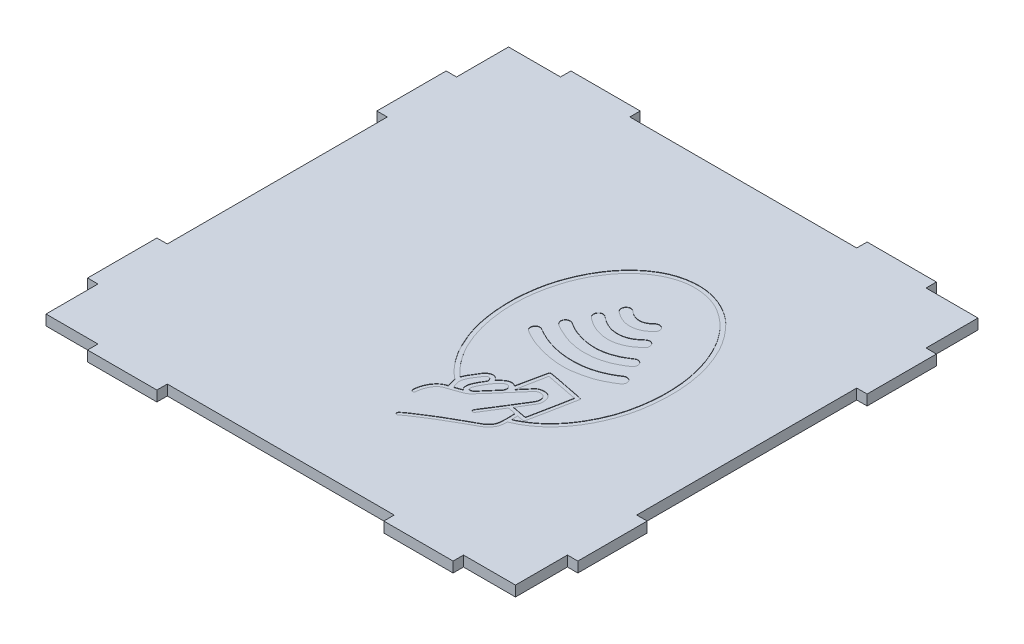
from build123d import *

# Parameters (mm, degrees)
SKETCH1_W           = 135.499999433
SKETCH1_H           = 133.500000388
BOSS_EXTRUDE1_DEPTH = 3
SKETCH2_W           = 3
SKETCH2_H           = 20
SKETCH2_W_2         = 20
SKETCH2_H_2         = 3
BOSS_EXTRUDE2_DEPTH = 3
CUT_EXTRUDE1_DEPTH  = 0.1


with BuildPart() as part:
    # Sketch1 → Boss-Extrude1 (new body)
    with BuildSketch(Plane(origin=(0, 0, 0), x_dir=(1, 0, 0), z_dir=(0, 1, 0))):
        with Locations((16.289033152, -9.949375056)):
            Rectangle(SKETCH1_W, SKETCH1_H)
    extrude(amount=BOSS_EXTRUDE1_DEPTH)

    # Sketch2 → Boss-Extrude2 (add, through all)
    with BuildSketch(Plane(origin=(0, 3, 0), x_dir=(1, 0, 0), z_dir=(0, 1, 0))):
        with Locations((85.539032868, 31.800625138)):
            Rectangle(SKETCH2_W, SKETCH2_H)
        with Locations((85.539032868, -51.69937525)):
            Rectangle(SKETCH2_W, SKETCH2_H)
        with Locations((59.039032868, 58.300625138)):
            Rectangle(SKETCH2_W_2, SKETCH2_H_2)
        with Locations((-26.460966565, 58.300625138)):
            Rectangle(SKETCH2_W_2, SKETCH2_H_2)
        with Locations((-52.960966565, 31.800625138)):
            Rectangle(SKETCH2_W, SKETCH2_H)
        with Locations((-52.960966565, -51.69937525)):
            Rectangle(SKETCH2_W, SKETCH2_H)
        with Locations((-26.460966565, -78.19937525)):
            Rectangle(SKETCH2_W_2, SKETCH2_H_2)
        with Locations((59.039032868, -78.19937525)):
            Rectangle(SKETCH2_W_2, SKETCH2_H_2)
    extrude(amount=-BOSS_EXTRUDE2_DEPTH)

    # Sketch3 → Cut-Extrude1 (cut)
    # profile 1 of 5: a face of its own
    with BuildSketch(Plane(origin=(0, 3, 0), x_dir=(1, 0, 0), z_dir=(0, 1, 0))):
        with BuildLine():
            Line((34.113919472, -30.520381706), (36.462919472, -27.796681706))
            add(Edge.make_bspline(
                [(36.462919472, -27.796681706), (36.724119472, -27.514181706), (36.884819472, -27.340481706), (37.062419472, -27.114381706)],
                knots=[0.144736842, 0.144736842, 0.144736842, 0.144736842, 0.157894737, 0.157894737, 0.157894737, 0.157894737], degree=3))
            Line((37.062419472, -27.114381706), (38.248619472, -25.733481706))
            add(Edge.make_bspline(
                [(38.248619472, -25.733481706), (39.168819472, -24.607781706), (41.105019472, -24.897481706), (41.282419472, -26.573781706)],
                knots=[0.171052632, 0.171052632, 0.171052632, 0.171052632, 0.184210526, 0.184210526, 0.184210526, 0.184210526], degree=3))
            add(Edge.make_bspline(
                [(41.282419472, -26.573781706), (41.413619472, -27.814081706), (40.244919472, -29.062881706), (39.663919472, -30.104281706)],
                knots=[0.184210526, 0.184210526, 0.184210526, 0.184210526, 0.197368421, 0.197368421, 0.197368421, 0.197368421], degree=3))
            add(Edge.make_bspline(
                [(39.663919472, -30.104281706), (39.061319472, -31.184381706), (38.339819472, -32.240581706), (37.705619472, -33.282181706)],
                knots=[0.197368421, 0.197368421, 0.197368421, 0.197368421, 0.210526316, 0.210526316, 0.210526316, 0.210526316], degree=3))
            add(Edge.make_bspline(
                [(37.705619472, -33.282181706), (37.027619472, -34.395381706), (36.380419472, -35.344381706), (35.718619472, -36.432181706)],
                knots=[0.210526316, 0.210526316, 0.210526316, 0.210526316, 0.223684211, 0.223684211, 0.223684211, 0.223684211], degree=3))
            add(Edge.make_bspline(
                [(35.718619472, -36.432181706), (35.244019472, -37.212081706), (34.645919472, -37.971481706), (34.221619472, -38.788281706)],
                knots=[0.223684211, 0.223684211, 0.223684211, 0.223684211, 0.236842105, 0.236842105, 0.236842105, 0.236842105], degree=3))
            add(Edge.make_bspline(
                [(34.221619472, -38.788281706), (34.040219472, -39.137581706), (34.170019472, -39.548481706), (34.599719472, -39.569881706)],
                knots=[0.236842105, 0.236842105, 0.236842105, 0.236842105, 0.25, 0.25, 0.25, 0.25], degree=3))
            add(Edge.make_bspline(
                [(34.599719472, -39.569881706), (35.000419472, -39.589881706), (35.115719472, -39.261981706), (35.310919472, -38.968281706)],
                knots=[0.25, 0.25, 0.25, 0.25, 0.263157895, 0.263157895, 0.263157895, 0.263157895], degree=3))
            add(Edge.make_bspline(
                [(35.310919472, -38.968281706), (35.496219472, -38.689581706), (35.620919472, -38.451581706), (35.803419472, -38.175081706)],
                knots=[0.263157895, 0.263157895, 0.263157895, 0.263157895, 0.276315789, 0.276315789, 0.276315789, 0.276315789], degree=3))
            add(Edge.make_bspline(
                [(35.803419472, -38.175081706), (36.089219472, -37.742281706), (38.603719472, -33.849081706), (38.762619472, -33.456381706)],
                knots=[0.276315789, 0.276315789, 0.276315789, 0.276315789, 0.289473684, 0.289473684, 0.289473684, 0.289473684], degree=3))
            add(Edge.make_bspline(
                [(38.762619472, -33.456381706), (39.336519472, -33.572381706), (40.618619472, -33.750081706), (41.081219472, -33.955381706)],
                knots=[0.289473684, 0.289473684, 0.289473684, 0.289473684, 0.302631579, 0.302631579, 0.302631579, 0.302631579], degree=3))
            add(Edge.make_bspline(
                [(41.081219472, -33.955381706), (41.209919472, -34.967681706), (41.165219472, -36.951181706), (41.087519472, -38.003681706)],
                knots=[0.302631579, 0.302631579, 0.302631579, 0.302631579, 0.315789474, 0.315789474, 0.315789474, 0.315789474], degree=3))
            add(Edge.make_bspline(
                [(41.087519472, -38.003681706), (40.890719472, -40.670381706), (38.284119472, -41.465981706), (36.307419472, -42.598581706)],
                knots=[0.315789474, 0.315789474, 0.315789474, 0.315789474, 0.328947368, 0.328947368, 0.328947368, 0.328947368], degree=3))
            add(Edge.make_bspline(
                [(36.307419472, -42.598581706), (36.058019472, -42.741581706), (35.851419472, -42.860081706), (35.616519472, -42.995581706)],
                knots=[0.328947368, 0.328947368, 0.328947368, 0.328947368, 0.342105263, 0.342105263, 0.342105263, 0.342105263], degree=3))
            add(Edge.make_bspline(
                [(35.616519472, -42.995581706), (33.473519472, -44.230681706), (31.072319472, -45.497781706), (29.024719472, -46.869781706)],
                knots=[0.342105263, 0.342105263, 0.342105263, 0.342105263, 0.355263158, 0.355263158, 0.355263158, 0.355263158], degree=3))
            Line((29.024719472, -46.869781706), (26.486319472, -48.501081706))
            add(Edge.make_bspline(
                [(26.486319472, -48.501081706), (25.663419472, -49.061381706), (24.760219472, -49.618181706), (24.029719472, -50.285681706)],
                knots=[0.368421053, 0.368421053, 0.368421053, 0.368421053, 0.381578947, 0.381578947, 0.381578947, 0.381578947], degree=3))
            add(Edge.make_bspline(
                [(24.029719472, -50.285681706), (23.475419472, -50.792181706), (24.011719472, -51.495981706), (24.602719472, -51.120681706)],
                knots=[0.381578947, 0.381578947, 0.381578947, 0.381578947, 0.394736842, 0.394736842, 0.394736842, 0.394736842], degree=3))
            add(Edge.make_bspline(
                [(24.602719472, -51.120681706), (24.698219472, -51.060081706), (24.785919472, -50.953681706), (24.879619472, -50.882181706)],
                knots=[0.394736842, 0.394736842, 0.394736842, 0.394736842, 0.407894737, 0.407894737, 0.407894737, 0.407894737], degree=3))
            Line((24.879619472, -50.882181706), (25.799219472, -50.198281706))
            add(Edge.make_bspline(
                [(25.799219472, -50.198281706), (27.664519472, -48.853681706), (29.151819472, -48.055481706), (30.862219472, -46.916781706)],
                knots=[0.421052632, 0.421052632, 0.421052632, 0.421052632, 0.434210526, 0.434210526, 0.434210526, 0.434210526], degree=3))
            Line((30.862219472, -46.916781706), (36.185719472, -43.831881706))
            add(Edge.make_bspline(
                [(36.185719472, -43.831881706), (37.343819472, -43.098781706), (39.190119472, -42.361981706), (40.177419472, -41.528881706)],
                knots=[0.447368421, 0.447368421, 0.447368421, 0.447368421, 0.460526316, 0.460526316, 0.460526316, 0.460526316], degree=3))
            add(Edge.make_bspline(
                [(40.177419472, -41.528881706), (40.380319472, -41.357681706), (40.513719472, -41.198281706), (40.707919472, -41.028281706)],
                knots=[0.460526316, 0.460526316, 0.460526316, 0.460526316, 0.473684211, 0.473684211, 0.473684211, 0.473684211], degree=3))
            add(Edge.make_bspline(
                [(40.707919472, -41.028281706), (40.952419472, -40.814281706), (41.019619472, -40.676081706), (41.204419472, -40.432381706)],
                knots=[0.473684211, 0.473684211, 0.473684211, 0.473684211, 0.486842105, 0.486842105, 0.486842105, 0.486842105], degree=3))
            add(Edge.make_bspline(
                [(41.204419472, -40.432381706), (42.177719472, -39.149081706), (41.902419472, -38.799981706), (42.133219472, -37.102381706)],
                knots=[0.486842105, 0.486842105, 0.486842105, 0.486842105, 0.5, 0.5, 0.5, 0.5], degree=3))
            add(Edge.make_bspline(
                [(42.133219472, -37.102381706), (42.688919472, -36.785481706), (43.560519472, -36.476181706), (44.213719472, -36.130381706)],
                knots=[0.5, 0.5, 0.5, 0.5, 0.513157895, 0.513157895, 0.513157895, 0.513157895], degree=3))
            add(Edge.make_bspline(
                [(44.213719472, -36.130381706), (45.519119472, -35.439181706), (46.781019472, -34.547481706), (47.897119472, -33.649881706)],
                knots=[0.513157895, 0.513157895, 0.513157895, 0.513157895, 0.526315789, 0.526315789, 0.526315789, 0.526315789], degree=3))
            add(Edge.make_bspline(
                [(47.897119472, -33.649881706), (48.757119472, -32.958181706), (49.555119472, -32.169981706), (50.308219472, -31.373981706)],
                knots=[0.526315789, 0.526315789, 0.526315789, 0.526315789, 0.539473684, 0.539473684, 0.539473684, 0.539473684], degree=3))
            add(Edge.make_bspline(
                [(50.308219472, -31.373981706), (50.433619472, -31.241381706), (50.522319472, -31.092581706), (50.657319472, -30.948081706)],
                knots=[0.539473684, 0.539473684, 0.539473684, 0.539473684, 0.552631579, 0.552631579, 0.552631579, 0.552631579], degree=3))
            Line((50.657319472, -30.948081706), (52.052119472, -29.263781706))
            add(Edge.make_bspline(
                [(52.052119472, -29.263781706), (53.104219472, -27.903081706), (53.908919472, -26.477981706), (54.748219472, -24.958581706)],
                knots=[0.565789474, 0.565789474, 0.565789474, 0.565789474, 0.578947368, 0.578947368, 0.578947368, 0.578947368], degree=3))
            add(Edge.make_bspline(
                [(54.748219472, -24.958581706), (55.461519472, -23.667281706), (56.100519472, -22.079381706), (56.634619472, -20.678481706)],
                knots=[0.578947368, 0.578947368, 0.578947368, 0.578947368, 0.592105263, 0.592105263, 0.592105263, 0.592105263], degree=3))
            add(Edge.make_bspline(
                [(56.634619472, -20.678481706), (58.525719472, -15.718581706), (59.162719472, -9.853781706), (58.930519472, -4.492081706)],
                knots=[0.592105263, 0.592105263, 0.592105263, 0.592105263, 0.605263158, 0.605263158, 0.605263158, 0.605263158], degree=3))
            add(Edge.make_bspline(
                [(58.930519472, -4.492081706), (58.627919472, 2.493518294), (56.333619472, 9.838818294), (52.325919472, 15.226618294)],
                knots=[0.605263158, 0.605263158, 0.605263158, 0.605263158, 0.618421053, 0.618421053, 0.618421053, 0.618421053], degree=3))
            Line((52.325919472, 15.226618294), (50.246319472, 17.767518294))
            add(Edge.make_bspline(
                [(50.246319472, 17.767518294), (49.320319472, 18.782018294), (48.145419472, 19.932718294), (46.977919472, 20.729818294)],
                knots=[0.631578947, 0.631578947, 0.631578947, 0.631578947, 0.644736842, 0.644736842, 0.644736842, 0.644736842], degree=3))
            add(Edge.make_bspline(
                [(46.977919472, 20.729818294), (46.815519472, 20.840618294), (46.720719472, 20.918918294), (46.536419472, 21.060318294)],
                knots=[0.644736842, 0.644736842, 0.644736842, 0.644736842, 0.657894737, 0.657894737, 0.657894737, 0.657894737], degree=3))
            add(Edge.make_bspline(
                [(46.536419472, 21.060318294), (45.991319472, 21.478618294), (44.740719472, 22.184118294), (44.132219472, 22.503018294)],
                knots=[0.657894737, 0.657894737, 0.657894737, 0.657894737, 0.671052632, 0.671052632, 0.671052632, 0.671052632], degree=3))
            add(Edge.make_bspline(
                [(44.132219472, 22.503018294), (42.322019472, 23.451918294), (40.509319472, 24.105318294), (38.254019472, 24.456518294)],
                knots=[0.671052632, 0.671052632, 0.671052632, 0.671052632, 0.684210526, 0.684210526, 0.684210526, 0.684210526], degree=3))
            add(Edge.make_bspline(
                [(38.254019472, 24.456518294), (33.943319472, 25.127618294), (29.130719472, 23.980718294), (25.790319472, 21.716318294)],
                knots=[0.684210526, 0.684210526, 0.684210526, 0.684210526, 0.697368421, 0.697368421, 0.697368421, 0.697368421], degree=3))
            Line((25.790319472, 21.716318294), (24.408219472, 20.784118294))
            add(Edge.make_bspline(
                [(24.408219472, 20.784118294), (24.229719472, 20.654518294), (24.138219472, 20.583518294), (23.977719472, 20.447418294)],
                knots=[0.710526316, 0.710526316, 0.710526316, 0.710526316, 0.723684211, 0.723684211, 0.723684211, 0.723684211], degree=3))
            add(Edge.make_bspline(
                [(23.977719472, 20.447418294), (23.791719472, 20.289818294), (23.696919472, 20.208618294), (23.560619472, 20.092818294)],
                knots=[0.723684211, 0.723684211, 0.723684211, 0.723684211, 0.736842105, 0.736842105, 0.736842105, 0.736842105], degree=3))
            add(Edge.make_bspline(
                [(23.560619472, 20.092818294), (23.372219472, 19.932618294), (23.318619472, 19.917318294), (23.138019472, 19.742118294)],
                knots=[0.736842105, 0.736842105, 0.736842105, 0.736842105, 0.75, 0.75, 0.75, 0.75], degree=3))
            add(Edge.make_bspline(
                [(23.138019472, 19.742118294), (22.915919472, 19.526618294), (22.907619472, 19.618218294), (22.710819472, 19.399918294)],
                knots=[0.75, 0.75, 0.75, 0.75, 0.763157895, 0.763157895, 0.763157895, 0.763157895], degree=3))
            add(Edge.make_bspline(
                [(22.710819472, 19.399918294), (22.095519472, 18.717418294), (21.344719472, 18.173718294), (20.757819472, 17.435318294)],
                knots=[0.763157895, 0.763157895, 0.763157895, 0.763157895, 0.776315789, 0.776315789, 0.776315789, 0.776315789], degree=3))
            add(Edge.make_bspline(
                [(20.757819472, 17.435318294), (20.297419472, 16.856018294), (19.802319472, 16.355918294), (19.370619472, 15.739318294)],
                knots=[0.776315789, 0.776315789, 0.776315789, 0.776315789, 0.789473684, 0.789473684, 0.789473684, 0.789473684], degree=3))
            Line((19.370619472, 15.739318294), (18.104619472, 13.923618294))
            add(Edge.make_bspline(
                [(18.104619472, 13.923618294), (16.392819472, 11.347018294), (15.138719472, 8.419018294), (14.155919472, 5.416518294)],
                knots=[0.802631579, 0.802631579, 0.802631579, 0.802631579, 0.815789474, 0.815789474, 0.815789474, 0.815789474], degree=3))
            add(Edge.make_bspline(
                [(14.155919472, 5.416518294), (13.705719472, 4.041218294), (13.159919472, 1.947118294), (12.950019472, 0.399018294)],
                knots=[0.815789474, 0.815789474, 0.815789474, 0.815789474, 0.828947368, 0.828947368, 0.828947368, 0.828947368], degree=3))
            add(Edge.make_bspline(
                [(12.950019472, 0.399018294), (12.688019472, -1.532581706), (12.434519472, -3.202781706), (12.365619472, -5.197681706)],
                knots=[0.828947368, 0.828947368, 0.828947368, 0.828947368, 0.842105263, 0.842105263, 0.842105263, 0.842105263], degree=3))
            add(Edge.make_bspline(
                [(12.365619472, -5.197681706), (12.292819472, -7.307181706), (12.385819472, -9.164581706), (12.560619472, -11.231981706)],
                knots=[0.842105263, 0.842105263, 0.842105263, 0.842105263, 0.855263158, 0.855263158, 0.855263158, 0.855263158], degree=3))
            add(Edge.make_bspline(
                [(12.560619472, -11.231981706), (12.639219472, -12.161981706), (12.821019472, -13.042081706), (12.937519472, -13.952681706)],
                knots=[0.855263158, 0.855263158, 0.855263158, 0.855263158, 0.868421053, 0.868421053, 0.868421053, 0.868421053], degree=3))
            add(Edge.make_bspline(
                [(12.937519472, -13.952681706), (13.178019472, -15.831081706), (14.178919472, -19.536281706), (14.920519472, -21.272881706)],
                knots=[0.868421053, 0.868421053, 0.868421053, 0.868421053, 0.881578947, 0.881578947, 0.881578947, 0.881578947], degree=3))
            add(Edge.make_bspline(
                [(14.920519472, -21.272881706), (16.104819472, -24.046081706), (17.120219472, -26.351181706), (18.957119472, -28.793781706)],
                knots=[0.881578947, 0.881578947, 0.881578947, 0.881578947, 0.894736842, 0.894736842, 0.894736842, 0.894736842], degree=3))
            add(Edge.make_bspline(
                [(18.957119472, -28.793781706), (19.088119472, -28.967981706), (19.154319472, -29.094881706), (19.302019472, -29.285881706)],
                knots=[0.894736842, 0.894736842, 0.894736842, 0.894736842, 0.907894737, 0.907894737, 0.907894737, 0.907894737], degree=3))
            Line((19.302019472, -29.285881706), (20.327819472, -30.568681706))
            add(Edge.make_bspline(
                [(20.327819472, -30.568681706), (20.480119472, -30.737381706), (20.517419472, -30.800081706), (20.693319472, -30.976381706)],
                knots=[0.921052632, 0.921052632, 0.921052632, 0.921052632, 0.934210526, 0.934210526, 0.934210526, 0.934210526], degree=3))
            add(Edge.make_bspline(
                [(20.693319472, -30.976381706), (20.973319472, -31.256881706), (21.081519472, -31.463681706), (21.429119472, -31.778681706)],
                knots=[0.934210526, 0.934210526, 0.934210526, 0.934210526, 0.947368421, 0.947368421, 0.947368421, 0.947368421], degree=3))
            add(Edge.make_bspline(
                [(21.429119472, -31.778681706), (21.737219472, -32.057881706), (21.924419472, -32.272381706), (22.224819472, -32.592681706)],
                knots=[0.947368421, 0.947368421, 0.947368421, 0.947368421, 0.960526316, 0.960526316, 0.960526316, 0.960526316], degree=3))
            add(Edge.make_bspline(
                [(22.224819472, -32.592681706), (22.502019472, -32.888381706), (23.779619472, -33.843281706), (23.845119472, -34.045181706)],
                knots=[0.960526316, 0.960526316, 0.960526316, 0.960526316, 0.973684211, 0.973684211, 0.973684211, 0.973684211], degree=3))
            add(Edge.make_bspline(
                [(23.845119472, -34.045181706), (24.063319472, -34.717081706), (23.855519472, -34.728381706), (24.531119472, -36.525281706)],
                knots=[0.973684211, 0.973684211, 0.973684211, 0.973684211, 1, 1, 1, 1], degree=3))
            add(Edge.make_bspline(
                [(24.531119472, -36.525281706), (23.929219472, -36.616181706), (23.221419472, -37.008081706), (22.813319472, -37.319581706)],
                knots=[0, 0, 0, 0, 0.013157895, 0.013157895, 0.013157895, 0.013157895], degree=3))
            add(Edge.make_bspline(
                [(22.813319472, -37.319581706), (21.324619472, -38.455481706), (20.371019472, -40.694281706), (20.332719472, -42.560881706)],
                knots=[0.013157895, 0.013157895, 0.013157895, 0.013157895, 0.026315789, 0.026315789, 0.026315789, 0.026315789], degree=3))
            add(Edge.make_bspline(
                [(20.332719472, -42.560881706), (20.323619472, -43.008081706), (20.580819472, -43.296981706), (21.023019472, -43.122181706)],
                knots=[0.026315789, 0.026315789, 0.026315789, 0.026315789, 0.039473684, 0.039473684, 0.039473684, 0.039473684], degree=3))
            add(Edge.make_bspline(
                [(21.023019472, -43.122181706), (21.375119472, -42.982981706), (21.307319472, -42.578781706), (21.369119472, -42.172181706)],
                knots=[0.039473684, 0.039473684, 0.039473684, 0.039473684, 0.052631579, 0.052631579, 0.052631579, 0.052631579], degree=3))
            add(Edge.make_bspline(
                [(21.369119472, -42.172181706), (21.471419472, -41.498781706), (21.674619472, -40.752281706), (21.936419472, -40.165281706)],
                knots=[0.052631579, 0.052631579, 0.052631579, 0.052631579, 0.065789474, 0.065789474, 0.065789474, 0.065789474], degree=3))
            add(Edge.make_bspline(
                [(21.936419472, -40.165281706), (22.979919472, -37.825981706), (24.129619472, -37.686181706), (26.409719472, -36.946781706)],
                knots=[0.065789474, 0.065789474, 0.065789474, 0.065789474, 0.078947368, 0.078947368, 0.078947368, 0.078947368], degree=3))
            add(Edge.make_bspline(
                [(26.409719472, -36.946781706), (27.066519472, -36.733781706), (27.657819472, -36.463281706), (28.280619472, -36.247581706)],
                knots=[0.078947368, 0.078947368, 0.078947368, 0.078947368, 0.092105263, 0.092105263, 0.092105263, 0.092105263], degree=3))
            add(Edge.make_bspline(
                [(28.280619472, -36.247581706), (29.127919472, -35.954281706), (29.291819472, -35.812281706), (29.888319472, -35.280481706)],
                knots=[0.092105263, 0.092105263, 0.092105263, 0.092105263, 0.105263158, 0.105263158, 0.105263158, 0.105263158], degree=3))
            add(Edge.make_bspline(
                [(29.888319472, -35.280481706), (30.633619472, -34.616081706), (32.641419472, -32.153481706), (33.530719472, -31.217481706)],
                knots=[0.105263158, 0.105263158, 0.105263158, 0.105263158, 0.118421053, 0.118421053, 0.118421053, 0.118421053], degree=3))
            add(Edge.make_bspline(
                [(33.530719472, -31.217481706), (33.767619472, -30.968181706), (33.871019472, -30.792781706), (34.113919472, -30.520381706)],
                knots=[0.118421053, 0.118421053, 0.118421053, 0.118421053, 0.131578947, 0.131578947, 0.131578947, 0.131578947], degree=3))
        make_face()
        with BuildLine():
            Line((17.205919472, -23.616181706), (15.842719472, -20.423481706))
            add(Edge.make_bspline(
                [(15.842719472, -20.423481706), (13.339119472, -13.490981706), (12.755019472, -5.466581706), (14.398119472, 1.726218294)],
                knots=[0.289473684, 0.289473684, 0.289473684, 0.289473684, 0.315789474, 0.315789474, 0.315789474, 0.315789474], degree=3))
            add(Edge.make_bspline(
                [(14.398119472, 1.726218294), (14.872819472, 3.804718294), (15.708419472, 6.935118294), (16.671419472, 8.817818294)],
                knots=[0.315789474, 0.315789474, 0.315789474, 0.315789474, 0.342105263, 0.342105263, 0.342105263, 0.342105263], degree=3))
            add(Edge.make_bspline(
                [(16.671419472, 8.817818294), (17.207719472, 9.866118294), (17.635219472, 10.976118294), (18.244019472, 11.930118294)],
                knots=[0.342105263, 0.342105263, 0.342105263, 0.342105263, 0.368421053, 0.368421053, 0.368421053, 0.368421053], degree=3))
            Line((18.244019472, 11.930118294), (20.097219472, 14.763118294))
            add(Edge.make_bspline(
                [(20.097219472, 14.763118294), (22.629019472, 18.291118294), (26.536919472, 21.441518294), (30.828919472, 22.762518294)],
                knots=[0.394736842, 0.394736842, 0.394736842, 0.394736842, 0.421052632, 0.421052632, 0.421052632, 0.421052632], degree=3))
            add(Edge.make_bspline(
                [(30.828919472, 22.762518294), (33.695019472, 23.644618294), (36.064819472, 23.676718294), (39.108519472, 23.123318294)],
                knots=[0.421052632, 0.421052632, 0.421052632, 0.421052632, 0.447368421, 0.447368421, 0.447368421, 0.447368421], degree=3))
            add(Edge.make_bspline(
                [(39.108519472, 23.123318294), (40.565519472, 22.858518294), (42.901419472, 22.008218294), (44.173919472, 21.200818294)],
                knots=[0.447368421, 0.447368421, 0.447368421, 0.447368421, 0.473684211, 0.473684211, 0.473684211, 0.473684211], degree=3))
            add(Edge.make_bspline(
                [(44.173919472, 21.200818294), (46.761719472, 19.558818294), (47.650619472, 18.831718294), (49.905119472, 16.403318294)],
                knots=[0.473684211, 0.473684211, 0.473684211, 0.473684211, 0.5, 0.5, 0.5, 0.5], degree=3))
            add(Edge.make_bspline(
                [(49.905119472, 16.403318294), (50.162619472, 16.126018294), (50.228719472, 16.019518294), (50.462919472, 15.738818294)],
                knots=[0.5, 0.5, 0.5, 0.5, 0.526315789, 0.526315789, 0.526315789, 0.526315789], degree=3))
            Line((50.462919472, 15.738818294), (52.181919472, 13.418018294))
            add(Edge.make_bspline(
                [(52.181919472, 13.418018294), (52.955119472, 12.094618294), (53.302319472, 11.606918294), (54.071819472, 10.047018294)],
                knots=[0.552631579, 0.552631579, 0.552631579, 0.552631579, 0.578947368, 0.578947368, 0.578947368, 0.578947368], degree=3))
            add(Edge.make_bspline(
                [(54.071819472, 10.047018294), (56.294119472, 5.542618294), (57.608719472, 0.222818294), (57.787919472, -4.948581706)],
                knots=[0.578947368, 0.578947368, 0.578947368, 0.578947368, 0.605263158, 0.605263158, 0.605263158, 0.605263158], degree=3))
            add(Edge.make_bspline(
                [(57.787919472, -4.948581706), (57.913719472, -8.578681706), (57.778519472, -10.199581706), (57.267319472, -13.615381706)],
                knots=[0.605263158, 0.605263158, 0.605263158, 0.605263158, 0.631578947, 0.631578947, 0.631578947, 0.631578947], degree=3))
            add(Edge.make_bspline(
                [(57.267319472, -13.615381706), (56.412519472, -19.327981706), (54.153019472, -24.367081706), (51.175819472, -28.453481706)],
                knots=[0.631578947, 0.631578947, 0.631578947, 0.631578947, 0.657894737, 0.657894737, 0.657894737, 0.657894737], degree=3))
            add(Edge.make_bspline(
                [(51.175819472, -28.453481706), (51.008419472, -28.683181706), (50.862319472, -28.890081706), (50.678319472, -29.112181706)],
                knots=[0.657894737, 0.657894737, 0.657894737, 0.657894737, 0.684210526, 0.684210526, 0.684210526, 0.684210526], degree=3))
            Line((50.678319472, -29.112181706), (49.037719472, -31.000981706))
            add(Edge.make_bspline(
                [(49.037719472, -31.000981706), (48.261619472, -31.795281706), (47.404119472, -32.547281706), (46.571819472, -33.216981706)],
                knots=[0.710526316, 0.710526316, 0.710526316, 0.710526316, 0.736842105, 0.736842105, 0.736842105, 0.736842105], degree=3))
            add(Edge.make_bspline(
                [(46.571819472, -33.216981706), (45.749319472, -33.878681706), (42.984419472, -35.653581706), (42.130419472, -35.802681706)],
                knots=[0.736842105, 0.736842105, 0.736842105, 0.736842105, 0.763157895, 0.763157895, 0.763157895, 0.763157895], degree=3))
            Line((42.130419472, -35.802681706), (42.095819472, -34.126581706))
            add(Edge.make_bspline(
                [(42.095819472, -34.126581706), (42.619719472, -34.181881706), (44.028219472, -34.663981706), (44.334919472, -34.253181706)],
                knots=[0.789473684, 0.789473684, 0.789473684, 0.789473684, 0.815789474, 0.815789474, 0.815789474, 0.815789474], degree=3))
            add(Edge.make_bspline(
                [(44.334919472, -34.253181706), (44.464219472, -34.079881706), (46.410519472, -23.867081706), (46.529019472, -23.289381706)],
                knots=[0.815789474, 0.815789474, 0.815789474, 0.815789474, 0.842105263, 0.842105263, 0.842105263, 0.842105263], degree=3))
            add(Edge.make_bspline(
                [(46.529019472, -23.289381706), (47.017719472, -20.906081706), (47.262919472, -20.746481706), (46.161019472, -20.524981706)],
                knots=[0.842105263, 0.842105263, 0.842105263, 0.842105263, 0.868421053, 0.868421053, 0.868421053, 0.868421053], degree=3))
            add(Edge.make_bspline(
                [(46.161019472, -20.524981706), (45.784619472, -20.449281706), (45.399719472, -20.369981706), (45.038019472, -20.305581706)],
                knots=[0.868421053, 0.868421053, 0.868421053, 0.868421053, 0.894736842, 0.894736842, 0.894736842, 0.894736842], degree=3))
            add(Edge.make_bspline(
                [(45.038019472, -20.305581706), (43.944119472, -20.111081706), (36.539519472, -18.573281706), (36.207419472, -18.612781706)],
                knots=[0.894736842, 0.894736842, 0.894736842, 0.894736842, 0.921052632, 0.921052632, 0.921052632, 0.921052632], degree=3))
            add(Edge.make_bspline(
                [(36.207419472, -18.612781706), (35.779219472, -18.663781706), (35.795919472, -18.976581706), (35.710319472, -19.419481706)],
                knots=[0.921052632, 0.921052632, 0.921052632, 0.921052632, 0.947368421, 0.947368421, 0.947368421, 0.947368421], degree=3))
            Line((35.710319472, -19.419481706), (34.100819472, -27.058781706))
            add(Edge.make_bspline(
                [(34.100819472, -27.058781706), (33.979119472, -26.879581706), (33.377919472, -26.605781706), (32.988819472, -26.581681706)],
                knots=[0, 0, 0, 0, 0.026315789, 0.026315789, 0.026315789, 0.026315789], degree=3))
            add(Edge.make_bspline(
                [(32.988819472, -26.581681706), (32.072519472, -26.524681706), (31.306319472, -27.053581706), (30.700319472, -27.617981706)],
                knots=[0.026315789, 0.026315789, 0.026315789, 0.026315789, 0.052631579, 0.052631579, 0.052631579, 0.052631579], degree=3))
            add(Edge.make_bspline(
                [(30.700319472, -27.617981706), (30.515319472, -27.790181706), (30.072419472, -28.193981706), (29.881719472, -28.460981706)],
                knots=[0.052631579, 0.052631579, 0.052631579, 0.052631579, 0.078947368, 0.078947368, 0.078947368, 0.078947368], degree=3))
            add(Edge.make_bspline(
                [(29.881719472, -28.460981706), (29.681719472, -28.170381706), (29.539719472, -27.875281706), (29.203619472, -27.665581706)],
                knots=[0.078947368, 0.078947368, 0.078947368, 0.078947368, 0.105263158, 0.105263158, 0.105263158, 0.105263158], degree=3))
            add(Edge.make_bspline(
                [(29.203619472, -27.665581706), (28.384319472, -27.154281706), (27.685419472, -27.338081706), (26.908919472, -27.870381706)],
                knots=[0.105263158, 0.105263158, 0.105263158, 0.105263158, 0.131578947, 0.131578947, 0.131578947, 0.131578947], degree=3))
            add(Edge.make_bspline(
                [(26.908919472, -27.870381706), (26.196419472, -28.358681706), (25.542619472, -29.818881706), (25.045119472, -30.565581706)],
                knots=[0.131578947, 0.131578947, 0.131578947, 0.131578947, 0.157894737, 0.157894737, 0.157894737, 0.157894737], degree=3))
            add(Edge.make_bspline(
                [(25.045119472, -30.565581706), (24.291719472, -31.696481706), (24.485319472, -31.559781706), (24.005219472, -32.584081706)],
                knots=[0.157894737, 0.157894737, 0.157894737, 0.157894737, 0.184210526, 0.184210526, 0.184210526, 0.184210526], degree=3))
            add(Edge.make_bspline(
                [(24.005219472, -32.584081706), (23.604219472, -32.289881706), (23.179819472, -31.884781706), (22.829419472, -31.536381706)],
                knots=[0.184210526, 0.184210526, 0.184210526, 0.184210526, 0.210526316, 0.210526316, 0.210526316, 0.210526316], degree=3))
            add(Edge.make_bspline(
                [(22.829419472, -31.536381706), (20.576719472, -29.296281706), (19.130819472, -27.219181706), (17.599419472, -24.380281706)],
                knots=[0.210526316, 0.210526316, 0.210526316, 0.210526316, 0.236842105, 0.236842105, 0.236842105, 0.236842105], degree=3))
            add(Edge.make_bspline(
                [(17.599419472, -24.380281706), (17.469019472, -24.138481706), (17.324119472, -23.857281706), (17.205919472, -23.616181706)],
                knots=[0.236842105, 0.236842105, 0.236842105, 0.236842105, 0.263157895, 0.263157895, 0.263157895, 0.263157895], degree=3))
        make_face(mode=Mode.SUBTRACT)
        with BuildLine():
            Line((45.281919472, -24.490081706), (45.833219472, -21.482681706))
            Line((45.833219472, -21.482681706), (36.674719472, -19.699981706))
            Line((36.674719472, -19.699981706), (35.108119472, -27.830681706))
            add(Edge.make_bspline(
                [(35.108119472, -27.830681706), (35.120919472, -27.818481706), (35.137719472, -27.802481706), (35.146319472, -27.793881706)],
                knots=[0.4, 0.4, 0.4, 0.4, 0.466666667, 0.466666667, 0.466666667, 0.466666667], degree=3))
            add(Edge.make_bspline(
                [(35.146319472, -27.793881706), (35.154719472, -27.785381706), (35.173619472, -27.767781706), (35.183819472, -27.757281706)],
                knots=[0.466666667, 0.466666667, 0.466666667, 0.466666667, 0.533333333, 0.533333333, 0.533333333, 0.533333333], degree=3))
            Line((35.183819472, -27.757281706), (37.711219472, -24.808381706))
            add(Edge.make_bspline(
                [(37.711219472, -24.808381706), (38.747219472, -23.697981706), (42.420719472, -23.432081706), (42.251719472, -27.153681706)],
                knots=[0.6, 0.6, 0.6, 0.6, 0.666666667, 0.666666667, 0.666666667, 0.666666667], degree=3))
            add(Edge.make_bspline(
                [(42.251719472, -27.153681706), (42.213319472, -27.997581706), (41.868419472, -28.468681706), (41.448519472, -29.119181706)],
                knots=[0.666666667, 0.666666667, 0.666666667, 0.666666667, 0.733333333, 0.733333333, 0.733333333, 0.733333333], degree=3))
            add(Edge.make_bspline(
                [(41.448519472, -29.119181706), (41.102719472, -29.654981706), (40.722319472, -30.314081706), (40.408219472, -30.841681706)],
                knots=[0.733333333, 0.733333333, 0.733333333, 0.733333333, 0.8, 0.8, 0.8, 0.8], degree=3))
            Line((40.408219472, -30.841681706), (39.355019472, -32.548481706))
            Line((39.355019472, -32.548481706), (43.532019472, -33.330681706))
            add(Edge.make_bspline(
                [(43.532019472, -33.330681706), (43.710219472, -32.357681706), (43.947719472, -31.370981706), (44.115019472, -30.381181706)],
                knots=[0, 0, 0, 0, 0.066666667, 0.066666667, 0.066666667, 0.066666667], degree=3))
            add(Edge.make_bspline(
                [(44.115019472, -30.381181706), (44.273319472, -29.444181706), (44.498219472, -28.346381706), (44.702419472, -27.445581706)],
                knots=[0.066666667, 0.066666667, 0.066666667, 0.066666667, 0.133333333, 0.133333333, 0.133333333, 0.133333333], degree=3))
            add(Edge.make_bspline(
                [(44.702419472, -27.445581706), (44.927419472, -26.453581706), (45.059619472, -25.476381706), (45.281919472, -24.490081706)],
                knots=[0.133333333, 0.133333333, 0.133333333, 0.133333333, 0.2, 0.2, 0.2, 0.2], degree=3))
        make_face(mode=Mode.SUBTRACT)
        with BuildLine():
            Line((30.315919472, -33.338781706), (32.831719472, -30.457981706))
            add(Edge.make_bspline(
                [(32.831719472, -30.457981706), (33.363219472, -29.815381706), (33.568919472, -29.869081706), (33.710519472, -29.026581706)],
                knots=[0.285714286, 0.285714286, 0.285714286, 0.285714286, 0.428571429, 0.428571429, 0.428571429, 0.428571429], degree=3))
            add(Edge.make_bspline(
                [(33.710519472, -29.026581706), (33.797919472, -28.506581706), (33.665719472, -28.273381706), (33.370219472, -27.992381706)],
                knots=[0.428571429, 0.428571429, 0.428571429, 0.428571429, 0.571428571, 0.571428571, 0.571428571, 0.571428571], degree=3))
            add(Edge.make_bspline(
                [(33.370219472, -27.992381706), (32.301819472, -26.976181706), (30.403219472, -29.624181706), (30.016619472, -30.272981706)],
                knots=[0.571428571, 0.571428571, 0.571428571, 0.571428571, 0.714285714, 0.714285714, 0.714285714, 0.714285714], degree=3))
            add(Edge.make_bspline(
                [(30.016619472, -30.272981706), (29.446319472, -31.229981706), (27.947219472, -33.325881706), (28.354619472, -34.469181706)],
                knots=[0.714285714, 0.714285714, 0.714285714, 0.714285714, 1, 1, 1, 1], degree=3))
            add(Edge.make_bspline(
                [(28.354619472, -34.469181706), (29.328919472, -34.629781706), (29.474919472, -34.288981706), (30.315919472, -33.338781706)],
                knots=[0, 0, 0, 0, 0.142857143, 0.142857143, 0.142857143, 0.142857143], degree=3))
        make_face(mode=Mode.SUBTRACT)
        with BuildLine():
            Line((25.674319472, -36.123281706), (27.681519472, -35.424381706))
            add(Edge.make_bspline(
                [(27.681519472, -35.424381706), (27.442319472, -35.114181706), (27.251719472, -35.015881706), (27.144819472, -34.532881706)],
                knots=[0, 0, 0, 0, 0.090909091, 0.090909091, 0.090909091, 0.090909091], degree=3))
            add(Edge.make_bspline(
                [(27.144819472, -34.532881706), (26.912119472, -33.481081706), (27.491519472, -32.294181706), (27.971019472, -31.444481706)],
                knots=[0.090909091, 0.090909091, 0.090909091, 0.090909091, 0.181818182, 0.181818182, 0.181818182, 0.181818182], degree=3))
            add(Edge.make_bspline(
                [(27.971019472, -31.444481706), (28.135719472, -31.152781706), (28.309719472, -30.876681706), (28.461019472, -30.583881706)],
                knots=[0.181818182, 0.181818182, 0.181818182, 0.181818182, 0.272727273, 0.272727273, 0.272727273, 0.272727273], degree=3))
            add(Edge.make_bspline(
                [(28.461019472, -30.583881706), (28.577519472, -30.358581706), (28.902419472, -29.895981706), (28.956719472, -29.732681706)],
                knots=[0.272727273, 0.272727273, 0.272727273, 0.272727273, 0.363636364, 0.363636364, 0.363636364, 0.363636364], degree=3))
            add(Edge.make_bspline(
                [(28.956719472, -29.732681706), (29.050019472, -29.452581706), (28.821719472, -28.910681706), (28.688619472, -28.756881706)],
                knots=[0.363636364, 0.363636364, 0.363636364, 0.363636364, 0.454545455, 0.454545455, 0.454545455, 0.454545455], degree=3))
            add(Edge.make_bspline(
                [(28.688619472, -28.756881706), (28.444219472, -28.474581706), (28.134719472, -28.502881706), (27.781519472, -28.686281706)],
                knots=[0.454545455, 0.454545455, 0.454545455, 0.454545455, 0.545454545, 0.545454545, 0.545454545, 0.545454545], degree=3))
            add(Edge.make_bspline(
                [(27.781519472, -28.686281706), (27.449419472, -28.858881706), (27.301219472, -29.119881706), (27.113419472, -29.420681706)],
                knots=[0.545454545, 0.545454545, 0.545454545, 0.545454545, 0.636363636, 0.636363636, 0.636363636, 0.636363636], degree=3))
            add(Edge.make_bspline(
                [(27.113419472, -29.420681706), (26.319119472, -30.692881706), (24.863119472, -32.581781706), (25.022019472, -34.088081706)],
                knots=[0.636363636, 0.636363636, 0.636363636, 0.636363636, 0.727272727, 0.727272727, 0.727272727, 0.727272727], degree=3))
            add(Edge.make_bspline(
                [(25.022019472, -34.088081706), (25.081519472, -34.652381706), (25.413519472, -35.727881706), (25.674319472, -36.123281706)],
                knots=[0.727272727, 0.727272727, 0.727272727, 0.727272727, 0.818181818, 0.818181818, 0.818181818, 0.818181818], degree=3))
        make_face(mode=Mode.SUBTRACT)
    # profile 2 of 5: a face of its own
    with BuildSketch(Plane(origin=(0, 3, 0), x_dir=(1, 0, 0), z_dir=(0, 1, 0))):
        with BuildLine():
            Line((44.336019472, -3.190281706), (43.740919472, -3.557381706))
            add(Edge.make_bspline(
                [(43.740919472, -3.557381706), (43.083819472, -3.930281706), (42.728519472, -4.226781706), (41.848219472, -4.609781706)],
                knots=[0.214285714, 0.214285714, 0.214285714, 0.214285714, 0.285714286, 0.285714286, 0.285714286, 0.285714286], degree=3))
            add(Edge.make_bspline(
                [(41.848219472, -4.609781706), (39.812819472, -5.495081706), (37.854219472, -5.996881706), (35.301119472, -5.874781706)],
                knots=[0.285714286, 0.285714286, 0.285714286, 0.285714286, 0.357142857, 0.357142857, 0.357142857, 0.357142857], degree=3))
            add(Edge.make_bspline(
                [(35.301119472, -5.874781706), (32.820919472, -5.756081706), (29.770019472, -4.843881706), (27.798419472, -3.647781706)],
                knots=[0.357142857, 0.357142857, 0.357142857, 0.357142857, 0.428571429, 0.428571429, 0.428571429, 0.428571429], degree=3))
            Line((27.798419472, -3.647781706), (26.548419472, -2.904481706))
            add(Edge.make_bspline(
                [(26.548419472, -2.904481706), (24.953819472, -2.160781706), (23.494719472, -4.302281706), (25.431119472, -5.505981706)],
                knots=[0.5, 0.5, 0.5, 0.5, 0.571428571, 0.571428571, 0.571428571, 0.571428571], degree=3))
            add(Edge.make_bspline(
                [(25.431119472, -5.505981706), (25.839119472, -5.759581706), (26.248519472, -6.022881706), (26.692219472, -6.239181706)],
                knots=[0.571428571, 0.571428571, 0.571428571, 0.571428571, 0.642857143, 0.642857143, 0.642857143, 0.642857143], degree=3))
            add(Edge.make_bspline(
                [(26.692219472, -6.239181706), (29.715419472, -7.712181706), (32.368319472, -8.691381706), (36.009619472, -8.683881706)],
                knots=[0.642857143, 0.642857143, 0.642857143, 0.642857143, 0.714285714, 0.714285714, 0.714285714, 0.714285714], degree=3))
            add(Edge.make_bspline(
                [(36.009619472, -8.683881706), (38.458519472, -8.678781706), (40.565119472, -8.172581706), (42.536519472, -7.367181706)],
                knots=[0.714285714, 0.714285714, 0.714285714, 0.714285714, 0.785714286, 0.785714286, 0.785714286, 0.785714286], degree=3))
            add(Edge.make_bspline(
                [(42.536519472, -7.367181706), (43.496019472, -6.975181706), (45.486119472, -5.899381706), (46.256219472, -5.238681706)],
                knots=[0.785714286, 0.785714286, 0.785714286, 0.785714286, 0.857142857, 0.857142857, 0.857142857, 0.857142857], degree=3))
            add(Edge.make_bspline(
                [(46.256219472, -5.238681706), (46.607619472, -4.937081706), (46.864119472, -4.445981706), (46.719519472, -3.886881706)],
                knots=[0.857142857, 0.857142857, 0.857142857, 0.857142857, 1, 1, 1, 1], degree=3))
            add(Edge.make_bspline(
                [(46.719519472, -3.886881706), (46.588819472, -3.382081706), (46.510219472, -3.028281706), (45.825819472, -2.827881706)],
                knots=[0, 0, 0, 0, 0.071428571, 0.071428571, 0.071428571, 0.071428571], degree=3))
            add(Edge.make_bspline(
                [(45.825819472, -2.827881706), (45.138219472, -2.626581706), (44.759519472, -2.875281706), (44.336019472, -3.190281706)],
                knots=[0.071428571, 0.071428571, 0.071428571, 0.071428571, 0.142857143, 0.142857143, 0.142857143, 0.142857143], degree=3))
        make_face()
    # profile 3 of 5: a face of its own
    with BuildSketch(Plane(origin=(0, 3, 0), x_dir=(1, 0, 0), z_dir=(0, 1, 0))):
        with BuildLine():
            Line((41.630519472, -0.103181706), (43.341319472, 1.272018294))
            add(Edge.make_bspline(
                [(43.341319472, 1.272018294), (44.342319472, 2.210318294), (43.454419472, 4.155618294), (41.979719472, 3.636418294)],
                knots=[0.8, 0.8, 0.8, 0.8, 1, 1, 1, 1], degree=3))
            add(Edge.make_bspline(
                [(41.979719472, 3.636418294), (41.461719472, 3.453918294), (40.814219472, 2.759918294), (40.242019472, 2.317618294)],
                knots=[0, 0, 0, 0, 0.1, 0.1, 0.1, 0.1], degree=3))
            add(Edge.make_bspline(
                [(40.242019472, 2.317618294), (38.208819472, 0.745518294), (35.418819472, 0.469118294), (33.041519472, 1.408418294)],
                knots=[0.1, 0.1, 0.1, 0.1, 0.2, 0.2, 0.2, 0.2], degree=3))
            add(Edge.make_bspline(
                [(33.041519472, 1.408418294), (30.688119472, 2.338418294), (29.925219472, 3.563718294), (29.140119472, 3.693118294)],
                knots=[0.2, 0.2, 0.2, 0.2, 0.3, 0.3, 0.3, 0.3], degree=3))
            add(Edge.make_bspline(
                [(29.140119472, 3.693118294), (28.188619472, 3.850118294), (27.474819472, 3.103218294), (27.539319472, 2.190218294)],
                knots=[0.3, 0.3, 0.3, 0.3, 0.4, 0.4, 0.4, 0.4], degree=3))
            add(Edge.make_bspline(
                [(27.539319472, 2.190218294), (27.593719472, 1.421018294), (28.374619472, 0.925318294), (28.928419472, 0.492518294)],
                knots=[0.4, 0.4, 0.4, 0.4, 0.5, 0.5, 0.5, 0.5], degree=3))
            add(Edge.make_bspline(
                [(28.928419472, 0.492518294), (29.906119472, -0.271681706), (31.571919472, -1.121881706), (33.062819472, -1.538781706)],
                knots=[0.5, 0.5, 0.5, 0.5, 0.6, 0.6, 0.6, 0.6], degree=3))
            add(Edge.make_bspline(
                [(33.062819472, -1.538781706), (36.333419472, -2.453181706), (38.973019472, -1.837081706), (41.630519472, -0.103181706)],
                knots=[0.6, 0.6, 0.6, 0.6, 0.7, 0.7, 0.7, 0.7], degree=3))
        make_face()
    # profile 4 of 5: a face of its own
    with BuildSketch(Plane(origin=(0, 3, 0), x_dir=(1, 0, 0), z_dir=(0, 1, 0))):
        with BuildLine():
            add(Edge.make_bspline(
                [(47.821419472, -8.713081706), (47.509619472, -8.794181706), (46.617319472, -9.404481706), (46.321319472, -9.597281706)],
                knots=[0, 0, 0, 0, 0.083333333, 0.083333333, 0.083333333, 0.083333333], degree=3))
            add(Edge.make_bspline(
                [(46.321319472, -9.597281706), (45.863419472, -9.895581706), (45.308119472, -10.165581706), (44.782019472, -10.432381706)],
                knots=[0.083333333, 0.083333333, 0.083333333, 0.083333333, 0.166666667, 0.166666667, 0.166666667, 0.166666667], degree=3))
            add(Edge.make_bspline(
                [(44.782019472, -10.432381706), (38.859219472, -13.436781706), (31.338519472, -12.824281706), (25.522719472, -9.836981706)],
                knots=[0.166666667, 0.166666667, 0.166666667, 0.166666667, 0.25, 0.25, 0.25, 0.25], degree=3))
            add(Edge.make_bspline(
                [(25.522719472, -9.836981706), (24.128719472, -9.120981706), (23.244019472, -8.198481706), (22.260619472, -8.971681706)],
                knots=[0.25, 0.25, 0.25, 0.25, 0.333333333, 0.333333333, 0.333333333, 0.333333333], degree=3))
            add(Edge.make_bspline(
                [(22.260619472, -8.971681706), (21.849719472, -9.294681706), (21.508819472, -9.999481706), (21.884719472, -10.717581706)],
                knots=[0.333333333, 0.333333333, 0.333333333, 0.333333333, 0.416666667, 0.416666667, 0.416666667, 0.416666667], degree=3))
            add(Edge.make_bspline(
                [(21.884719472, -10.717581706), (22.336819472, -11.580981706), (25.500019472, -12.939381706), (26.440519472, -13.295381706)],
                knots=[0.416666667, 0.416666667, 0.416666667, 0.416666667, 0.5, 0.5, 0.5, 0.5], degree=3))
            add(Edge.make_bspline(
                [(26.440519472, -13.295381706), (30.064119472, -14.667181706), (34.681919472, -15.670581706), (38.630819472, -15.081081706)],
                knots=[0.5, 0.5, 0.5, 0.5, 0.583333333, 0.583333333, 0.583333333, 0.583333333], degree=3))
            add(Edge.make_bspline(
                [(38.630819472, -15.081081706), (41.452319472, -14.659981706), (43.701419472, -14.112681706), (45.997019472, -12.945581706)],
                knots=[0.583333333, 0.583333333, 0.583333333, 0.583333333, 0.666666667, 0.666666667, 0.666666667, 0.666666667], degree=3))
            add(Edge.make_bspline(
                [(45.997019472, -12.945581706), (46.885619472, -12.493781706), (48.236819472, -11.765381706), (49.009719472, -11.203581706)],
                knots=[0.666666667, 0.666666667, 0.666666667, 0.666666667, 0.75, 0.75, 0.75, 0.75], degree=3))
            add(Edge.make_bspline(
                [(49.009719472, -11.203581706), (49.452819472, -10.881581706), (49.736819472, -10.147381706), (49.444419472, -9.487081706)],
                knots=[0.75, 0.75, 0.75, 0.75, 0.833333333, 0.833333333, 0.833333333, 0.833333333], degree=3))
            add(Edge.make_bspline(
                [(49.444419472, -9.487081706), (49.168119472, -8.862681706), (48.438119472, -8.552481706), (47.821419472, -8.713081706)],
                knots=[0.833333333, 0.833333333, 0.833333333, 0.833333333, 1, 1, 1, 1], degree=3))
        make_face()
    # profile 5 of 5: a face of its own
    with BuildSketch(Plane(origin=(0, 3, 0), x_dir=(1, 0, 0), z_dir=(0, 1, 0))):
        with BuildLine():
            add(Edge.make_bspline(
                [(39.604519472, 9.107918294), (39.015719472, 9.056818294), (38.606219472, 8.545118294), (38.272919472, 8.265618294)],
                knots=[0, 0, 0, 0, 0.1, 0.1, 0.1, 0.1], degree=3))
            add(Edge.make_bspline(
                [(38.272919472, 8.265618294), (36.771719472, 7.006818294), (34.957919472, 7.075418294), (33.399819472, 8.048518294)],
                knots=[0.1, 0.1, 0.1, 0.1, 0.2, 0.2, 0.2, 0.2], degree=3))
            add(Edge.make_bspline(
                [(33.399819472, 8.048518294), (32.950919472, 8.328818294), (32.391919472, 8.864518294), (32.153419472, 8.989718294)],
                knots=[0.2, 0.2, 0.2, 0.2, 0.3, 0.3, 0.3, 0.3], degree=3))
            add(Edge.make_bspline(
                [(32.153419472, 8.989718294), (31.013419472, 9.588218294), (29.583719472, 8.341518294), (30.319119472, 7.027018294)],
                knots=[0.3, 0.3, 0.3, 0.3, 0.4, 0.4, 0.4, 0.4], degree=3))
            add(Edge.make_bspline(
                [(30.319119472, 7.027018294), (30.546819472, 6.619918294), (31.050619472, 6.278818294), (31.434919472, 6.015218294)],
                knots=[0.4, 0.4, 0.4, 0.4, 0.5, 0.5, 0.5, 0.5], degree=3))
            add(Edge.make_bspline(
                [(31.434919472, 6.015218294), (33.467319472, 4.621318294), (35.755219472, 4.038618294), (38.158619472, 4.967818294)],
                knots=[0.5, 0.5, 0.5, 0.5, 0.6, 0.6, 0.6, 0.6], degree=3))
            add(Edge.make_bspline(
                [(38.158619472, 4.967818294), (38.696519472, 5.175818294), (39.166419472, 5.459418294), (39.570019472, 5.747218294)],
                knots=[0.6, 0.6, 0.6, 0.6, 0.7, 0.7, 0.7, 0.7], degree=3))
            add(Edge.make_bspline(
                [(39.570019472, 5.747218294), (40.010219472, 6.061118294), (40.421119472, 6.343418294), (40.768819472, 6.733318294)],
                knots=[0.7, 0.7, 0.7, 0.7, 0.8, 0.8, 0.8, 0.8], degree=3))
            add(Edge.make_bspline(
                [(40.768819472, 6.733318294), (41.656619472, 7.728518294), (41.029219472, 9.231318294), (39.604519472, 9.107918294)],
                knots=[0.8, 0.8, 0.8, 0.8, 1, 1, 1, 1], degree=3))
        make_face()
    extrude(amount=-CUT_EXTRUDE1_DEPTH, mode=Mode.SUBTRACT)


solid = part.part
